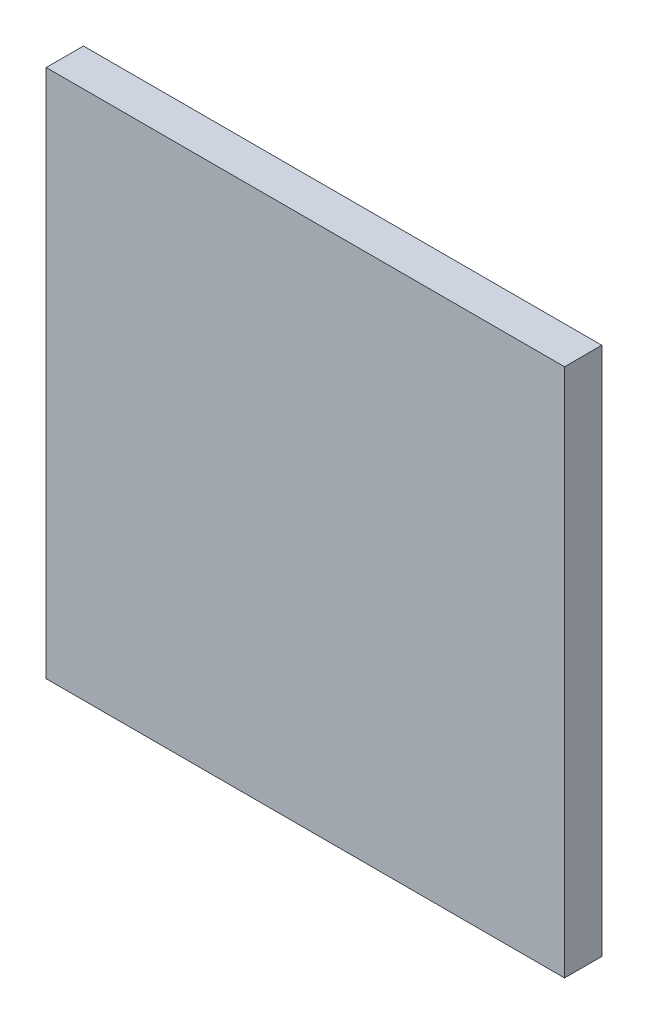
from build123d import *

# Parameters (mm, degrees)
SKETCH1_W               = 16
SKETCH1_H               = 16.34
COMPONENT_OUTLINE_DEPTH = 1.15


with BuildPart() as part:
    # Sketch1 → Component_Outline (new body)
    with BuildSketch(Plane.XY):
        with Locations((0, 0.92)):
            Rectangle(SKETCH1_W, SKETCH1_H)
    extrude(amount=COMPONENT_OUTLINE_DEPTH)


solid = part.part
